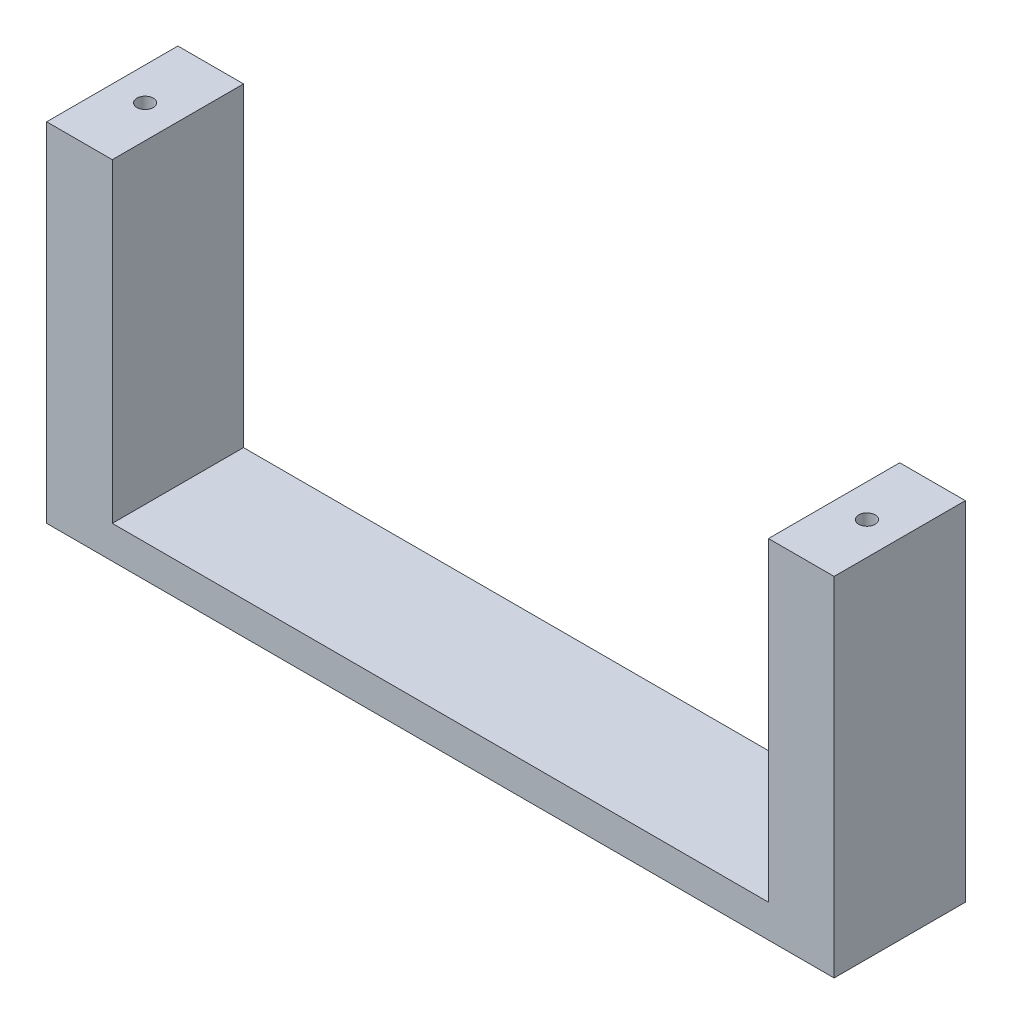
from build123d import *

# Parameters (mm, degrees)
CROQUIS1_W              = 120
CROQUIS1_H              = 20
SALIENTE_EXTRUIR1_DEPTH = 5
CROQUIS2_W              = 10
CROQUIS2_H              = 20
SALIENTE_EXTRUIR2_DEPTH = 48
CROQUIS3_R              = 1.25
CORTAR_EXTRUIR1_DEPTH   = 10


with BuildPart() as part:
    # Croquis1 → Saliente-Extruir1 (new body)
    with BuildSketch(Plane(origin=(0, 0, 0), x_dir=(1, 0, 0), z_dir=(0, 1, 0))):
        Rectangle(CROQUIS1_W, CROQUIS1_H)
    extrude(amount=SALIENTE_EXTRUIR1_DEPTH)

    # Croquis2 → Saliente-Extruir2 (add)
    with BuildSketch(Plane(origin=(0, 5, 0), x_dir=(1, 0, 0), z_dir=(0, 1, 0))):
        with Locations((55, 0)):
            Rectangle(CROQUIS2_W, CROQUIS2_H)
        with Locations((-55, 0)):
            Rectangle(CROQUIS2_W, CROQUIS2_H)
    extrude(amount=SALIENTE_EXTRUIR2_DEPTH)

    # Croquis3 → Cortar-Extruir1 (cut)
    with BuildSketch(Plane(origin=(0, 53, 0), x_dir=(1, 0, 0), z_dir=(0, 1, 0))):
        with Locations(Location((-55, 0, 0), (0, 0, 270))):
            Circle(CROQUIS3_R)
        with Locations(Location((55, 0, 0), (0, 0, 270))):
            Circle(CROQUIS3_R)
    extrude(amount=-CORTAR_EXTRUIR1_DEPTH, mode=Mode.SUBTRACT)


solid = part.part
